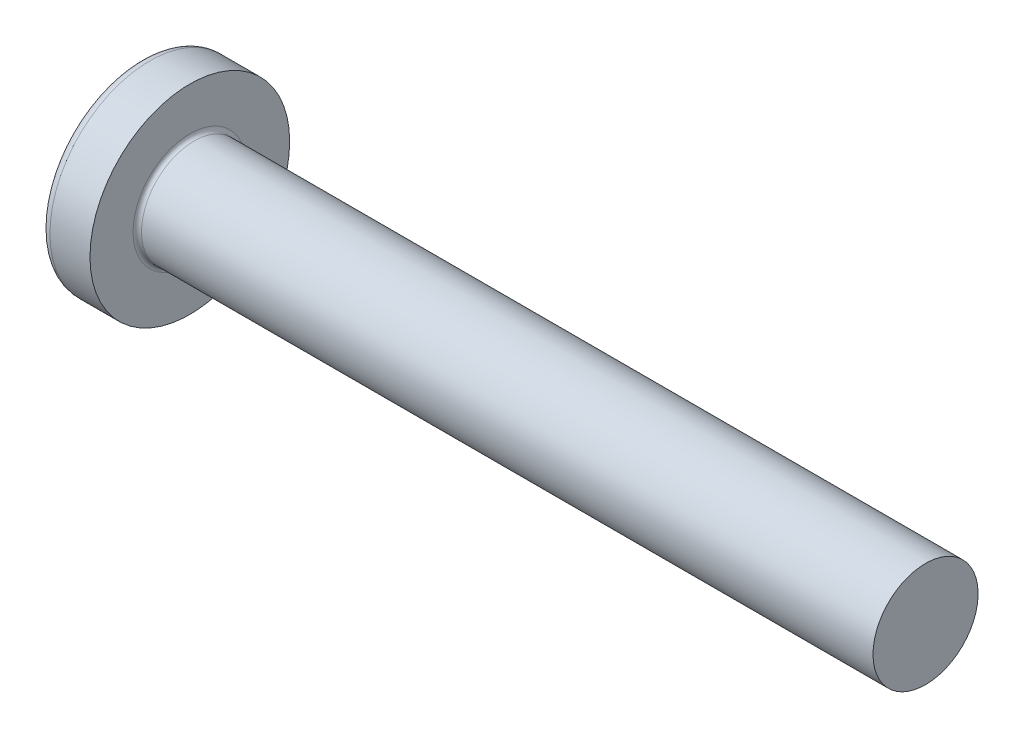
from build123d import *

# Parameters (mm, degrees)
FILLET1_R    = 0.2
RECPAT_COUNT = 2
RECPAT_ANGLE = 90


with BuildPart() as part:
    # BodySke → Base-Revolve (revolve)
    with BuildSketch(Plane.XY, mode=Mode.PRIVATE) as base_revolve_sk:
        with BuildLine():
            Line((3.7, 2.5), (3.7, 4.75))
            Line((3.7, 4.75), (1.79415598, 4.75))
            ThreePointArc((1.79415598, 4.75), (1.58538712, 4.698642149), (1.424271237, 4.556291391))
            ThreePointArc((1.424271237, 4.556291391), (0.364365445, 2.386856709), (0, 0))
            Line((0, 0), (38.7, 0))
            Line((38.7, 0), (38.7, 2.5))
            Line((38.7, 2.5), (3.7, 2.5))
        make_face()
    revolve(base_revolve_sk.sketch.rotate(Axis((1.79415598, 0, 0), (1, 0, 0)), 90), axis=Axis((1.79415598, 0, 0), (1, 0, 0)))

    # Fillet1
    fillet1_edges = [part.edges().sort_by_distance(p)[0] for p in [
        (3.7, 0, -2.5),
    ]]
    fillet(fillet1_edges, radius=FILLET1_R)

    # Sketch3 → Recess section 0
    with BuildSketch(Plane(origin=(0, 0, 0), x_dir=(0, 0, -1), z_dir=(1, 0, 0))):
        with BuildLine():
            Line((0.515, -2.35), (-0.515, -2.35))
            Line((-0.515, -2.35), (-0.515, 2.35))
            Line((-0.515, 2.35), (0.515, 2.35))
            Line((0.515, 2.35), (0.515, -2.35))
        make_face()
    # Sketch4 → Recess section 1
    with BuildSketch(Plane(origin=(2.74, 0, 0), x_dir=(0, 0, -1), z_dir=(1, 0, 0))):
        with BuildLine():
            Line((0.515, -0.983886441), (-0.515, -0.983886441))
            Line((-0.515, -0.983886441), (-0.515, 0.983886441))
            Line((-0.515, 0.983886441), (0.515, 0.983886441))
            Line((0.515, 0.983886441), (0.515, -0.983886441))
        make_face()
    recess = loft(mode=Mode.SUBTRACT)

    # RecPat: Recess ×2 about axis
    recpat_axis = Axis((0, 0, 0), (1, 0, 0))
    for i in range(1, RECPAT_COUNT):
        add(recess.rotate(recpat_axis, i * RECPAT_ANGLE / (RECPAT_COUNT - 1)), mode=Mode.SUBTRACT)

    # RecCorSke → RecessCore (revolve, cut)
    with BuildSketch(Plane.XY, mode=Mode.PRIVATE) as recesscore_sk:
        Polygon((0, 0), (0, 1.042599465), (2.74, 0.851), (3.016506661, 0), align=None)
    revolve(recesscore_sk.sketch.rotate(Axis((-3.175, 0, 0), (1, 0, 0)), 13.238159286), axis=Axis((-3.175, 0, 0), (1, 0, 0)), mode=Mode.SUBTRACT)


solid = part.part
